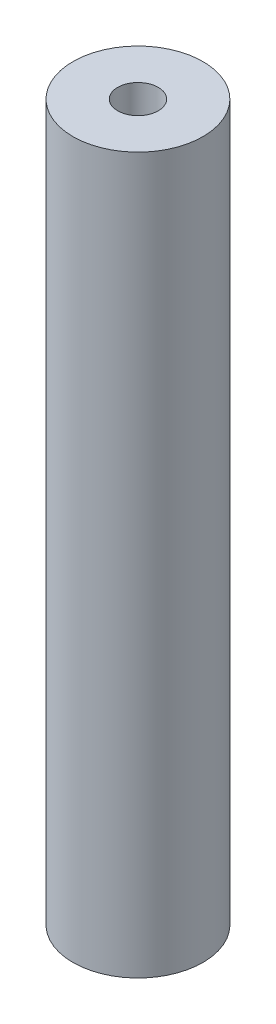
from build123d import *

# Parameters (mm, degrees)
SKETCH1_R               = 4
BOSS_EXTRUDE1_DEPTH     = 44
TAP_DRILL_FOR_M3_TAP1_D = 2.5


with BuildPart() as part:
    # Sketch1 → Boss-Extrude1 (new body)
    with BuildSketch(Plane(origin=(0, 0, 0), x_dir=(1, 0, 0), z_dir=(0, 1, 0))):
        with Locations(Location((0, 0, 0), (0, 0, 270))):
            Circle(SKETCH1_R)
    extrude(amount=BOSS_EXTRUDE1_DEPTH)

    # Tap Drill for M3 Tap1 (through all)
    with Locations(Plane(origin=(0, 44, 0), x_dir=(1, 0, 0), z_dir=(0, 1, 0))):
        with Locations((0, 0)):
            Hole(TAP_DRILL_FOR_M3_TAP1_D / 2)


solid = part.part
